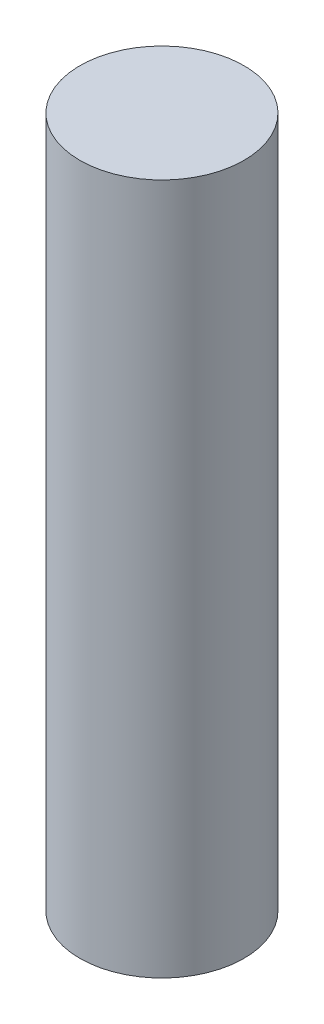
from build123d import *

# Parameters (mm, degrees)
SKETCH_1_R      = 4.5
EXTRUDE_1_DEPTH = 37.9


with BuildPart() as part:
    # 草图1 → 凸台-拉伸1 (new body)
    with BuildSketch(Plane(origin=(0, 0, 0), x_dir=(1, 0, 0), z_dir=(0, 1, 0))):
        with Locations(Location((-40.47892002, 21.842585556, 0), (0, 0, 270))):
            Circle(SKETCH_1_R)
    extrude(amount=EXTRUDE_1_DEPTH)


solid = part.part
